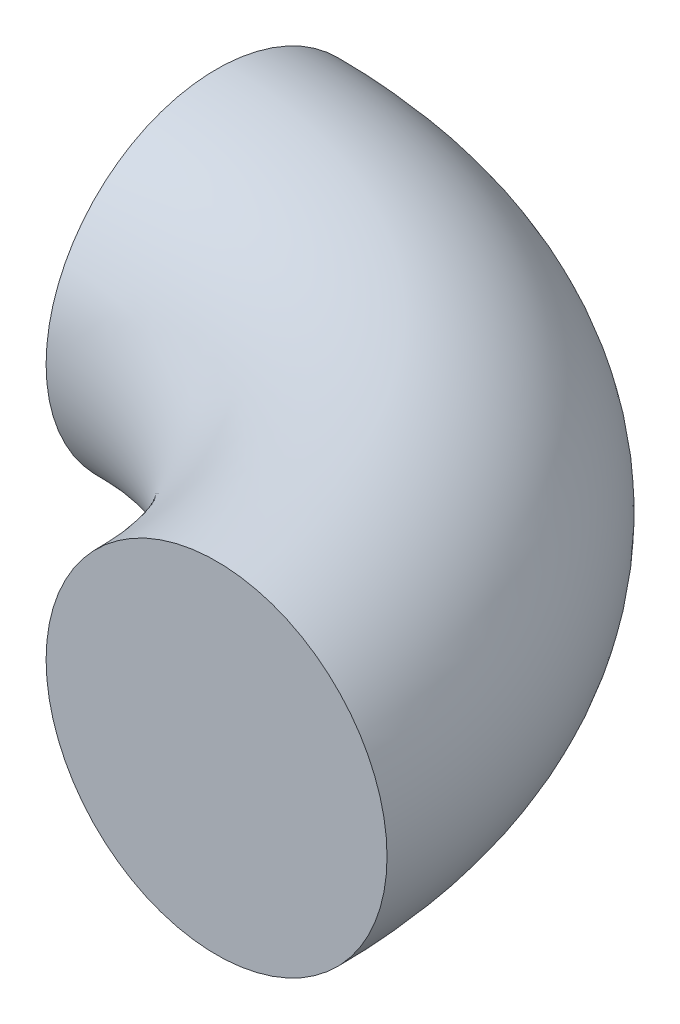
from build123d import *

# Parameters (mm, degrees)
SKETCH1_R      = 2
REVOLVE1_ANGLE = 90


with BuildPart() as part:
    # Sketch1 → Revolve1 (revolve)
    with BuildSketch(Plane.XY):
        with Locations((5, 0)):
            Circle(SKETCH1_R)
    revolve(axis=Axis((0, -3, 0), (0, 1, 0)), revolution_arc=REVOLVE1_ANGLE)


solid = part.part
